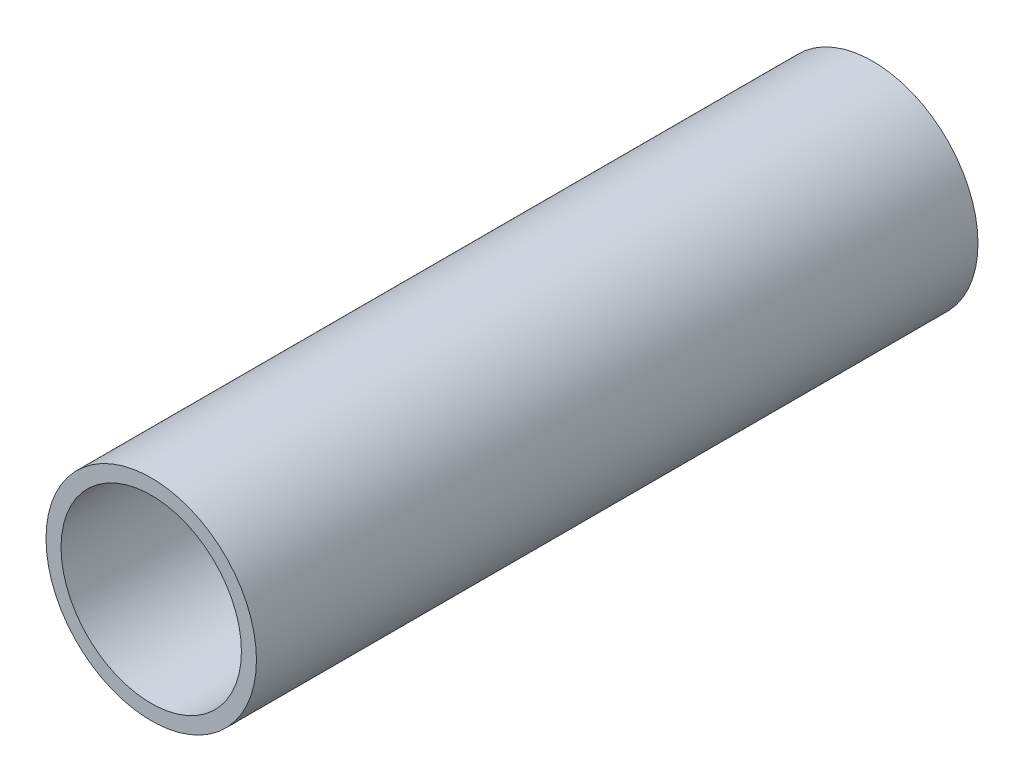
from build123d import *

# Parameters (mm, degrees)
SKETCH1_R           = 22.225
BOSS_EXTRUDE1_DEPTH = 152.4
SKETCH2_R           = 19.05
CUT_EXTRUDE1_DEPTH  = 156.607394587


with BuildPart() as part:
    # Sketch1 → Boss-Extrude1 (new body)
    with BuildSketch(Plane.XY):
        with Locations(Location((0, 0, 0), (0, 0, 180))):
            Circle(SKETCH1_R)
    extrude(amount=BOSS_EXTRUDE1_DEPTH)

    # Sketch2 → Cut-Extrude1 (cut, through all)
    with BuildSketch(Plane.XY.offset(152.4)):
        Circle(SKETCH2_R)
    extrude(amount=-CUT_EXTRUDE1_DEPTH, mode=Mode.SUBTRACT)


solid = part.part
